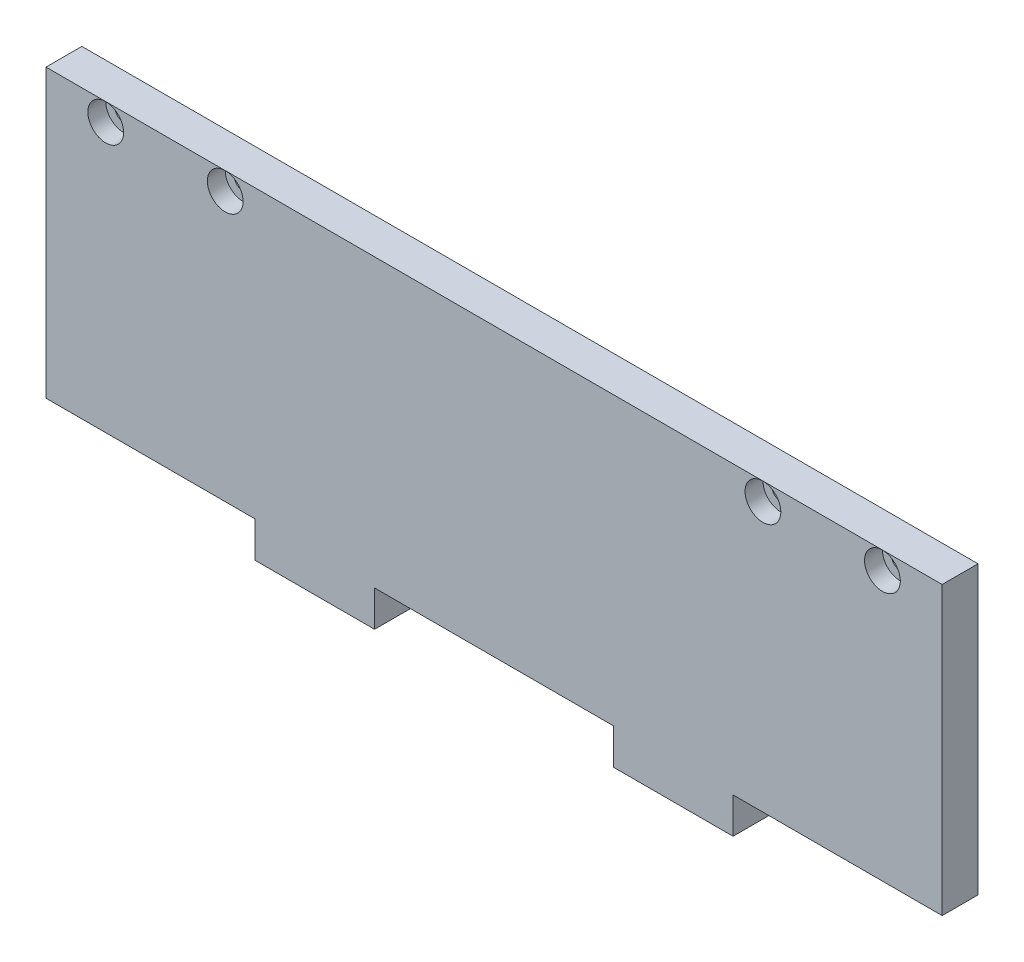
from build123d import *

# Parameters (mm, degrees)
ESQUISSE1_W             = 150
ESQUISSE1_H             = 54
BOSS_EXTRU_1_DEPTH      = 6
ESQUISSE2_W             = 35
ESQUISSE2_H             = 6
ESQUISSE2_W_2           = 40
ENL_V_MAT_EXTRU_1_DEPTH = 160.536829604
ESQUISSE4_R             = 1.5
ENL_V_MAT_EXTRU_3_DEPTH = 6
ESQUISSE5_R             = 2.995
ENL_V_MAT_EXTRU_4_DEPTH = 3


with BuildPart() as part:
    # Esquisse1 → Boss.-Extru.1 (new body)
    with BuildSketch(Plane.XY):
        with Locations((-75, 27)):
            Rectangle(ESQUISSE1_W, ESQUISSE1_H)
    extrude(amount=BOSS_EXTRU_1_DEPTH)

    # Esquisse2 → Enlèv. mat.-Extru.1 (cut, through all)
    with BuildSketch(Plane.XY.offset(6)):
        with Locations((-17.5, 3)):
            Rectangle(ESQUISSE2_W, ESQUISSE2_H)
        with Locations((-75, 3)):
            Rectangle(ESQUISSE2_W_2, ESQUISSE2_H)
        with Locations((-132.5, 3)):
            Rectangle(ESQUISSE2_W, ESQUISSE2_H)
    extrude(amount=-ENL_V_MAT_EXTRU_1_DEPTH, mode=Mode.SUBTRACT)

    # Esquisse4 → Enlèv. mat.-Extru.3 (cut)
    with BuildSketch(Plane.XY.offset(6)):
        with Locations((-140, 51)):
            Circle(ESQUISSE4_R)
        with Locations((-120, 51)):
            Circle(ESQUISSE4_R)
        with Locations(Location((-30, 51, 0), (0, 0, 180))):
            Circle(ESQUISSE4_R)
        with Locations(Location((-10, 51, 0), (0, 0, 180))):
            Circle(ESQUISSE4_R)
    extrude(amount=-ENL_V_MAT_EXTRU_3_DEPTH, mode=Mode.SUBTRACT)

    # Esquisse5 → Enlèv. mat.-Extru.4 (cut)
    with BuildSketch(Plane.XY.offset(6)):
        with Locations((-140, 51)):
            Circle(ESQUISSE5_R)
        with Locations((-120, 51)):
            Circle(ESQUISSE5_R)
        with Locations(Location((-30, 51, 0), (0, 0, 180))):
            Circle(ESQUISSE5_R)
        with Locations(Location((-10, 51, 0), (0, 0, 180))):
            Circle(ESQUISSE5_R)
    extrude(amount=-ENL_V_MAT_EXTRU_4_DEPTH, mode=Mode.SUBTRACT)


solid = part.part
